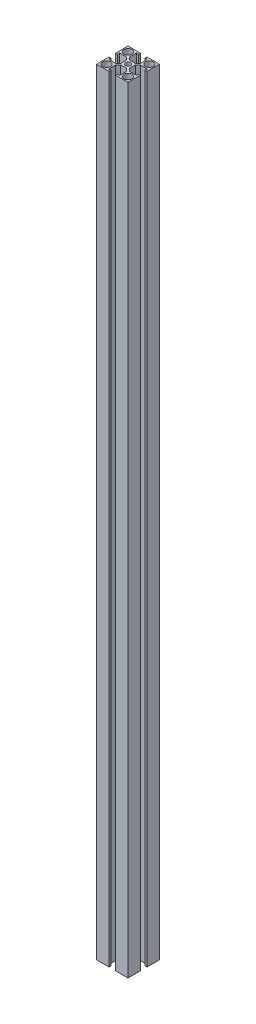
from build123d import *

# Parameters (mm, degrees)
SKETCH_2_R      = 3.8
SKETCH_2_W      = 8.2
SKETCH_2_H      = 8.2
SKETCH_2_R_2    = 2.4
EXTRUDE_1_DEPTH = 740


with BuildPart() as part:
    # 草图2 → 凸台-拉伸1 (new body)
    # profile 1 of 5: a face of its own
    with BuildSketch(Plane(origin=(0, 0, 0), x_dir=(1, 0, 0), z_dir=(0, 1, 0))):
        Polygon((-13.2, -3.15), (-15, -3.15), (-15, -15), (-3.15, -15), (-3.15, -13.2), (-5.25, -13.2), (-5.25, -6.522792206), (-2.827207794, -4.1), (-4.1, -4.1), (-4.1, -2.827207794), (-6.522792206, -5.25), (-13.2, -5.25), align=None)
        with Locations(Location((-10.223905857, -10.223905857, 0), (0, 0, 270))):
            Circle(SKETCH_2_R, mode=Mode.SUBTRACT)
    # profile 2 of 5: a face of its own
    with BuildSketch(Plane(origin=(0, 0, 0), x_dir=(1, 0, 0), z_dir=(0, 1, 0))):
        Rectangle(SKETCH_2_W, SKETCH_2_H)
        with Locations(Location((0, 0, 0), (0, 0, 270))):
            Circle(SKETCH_2_R_2, mode=Mode.SUBTRACT)
    # profile 3 of 5: a face of its own
    with BuildSketch(Plane(origin=(0, 0, 0), x_dir=(1, 0, 0), z_dir=(0, 1, 0))):
        Polygon((15, -15), (15, -3.15), (13.2, -3.15), (13.2, -5.25), (6.522792206, -5.25), (4.1, -2.827207794), (4.1, -4.1), (2.827207794, -4.1), (5.25, -6.522792206), (5.25, -13.2), (3.15, -13.2), (3.15, -15), align=None)
        with Locations(Location((10.223905857, -10.223905857, 0), (0, 0, 270))):
            Circle(SKETCH_2_R, mode=Mode.SUBTRACT)
    # profile 4 of 5: a face of its own
    with BuildSketch(Plane(origin=(0, 0, 0), x_dir=(1, 0, 0), z_dir=(0, 1, 0))):
        Polygon((15, 15), (3.15, 15), (3.15, 13.2), (5.25, 13.2), (5.25, 6.522792206), (2.827207794, 4.1), (4.1, 4.1), (4.1, 2.827207794), (6.522792206, 5.25), (13.2, 5.25), (13.2, 3.15), (15, 3.15), align=None)
        with Locations(Location((10.223905857, 10.223905857, 0), (0, 0, 270))):
            Circle(SKETCH_2_R, mode=Mode.SUBTRACT)
    # profile 5 of 5: a face of its own
    with BuildSketch(Plane(origin=(0, 0, 0), x_dir=(1, 0, 0), z_dir=(0, 1, 0))):
        Polygon((-3.15, 13.2), (-3.15, 15), (-15, 15), (-15, 3.15), (-13.2, 3.15), (-13.2, 5.25), (-6.522792206, 5.25), (-4.1, 2.827207794), (-4.1, 4.1), (-2.827207794, 4.1), (-5.25, 6.522792206), (-5.25, 13.2), align=None)
        with Locations(Location((-10.223905857, 10.223905857, 0), (0, 0, 270))):
            Circle(SKETCH_2_R, mode=Mode.SUBTRACT)
    extrude(amount=EXTRUDE_1_DEPTH)


solid = part.part
